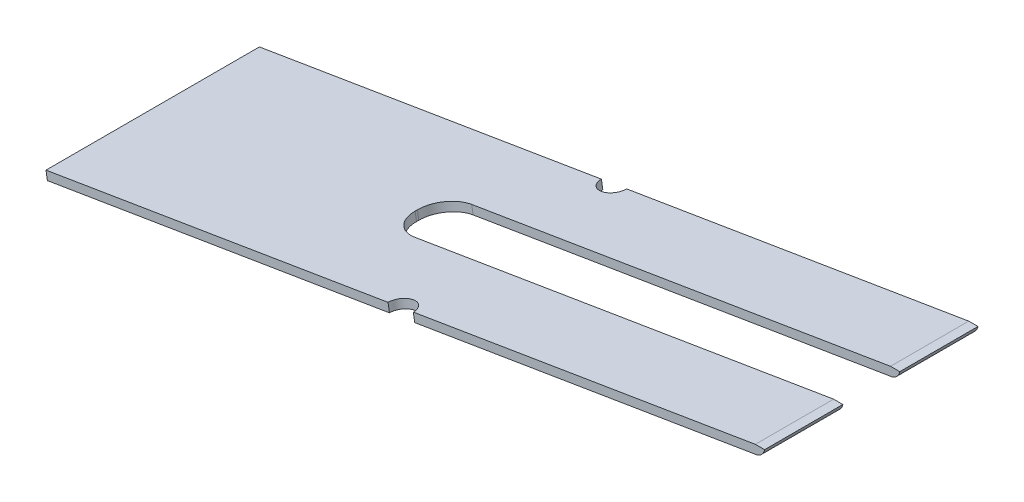
from build123d import *

# Parameters (mm, degrees)
SALIENTE_EXTRUIR1_DEPTH = 1.875
CROQUIS2_R              = 0.225
CORTAR_EXTRUIR1_DEPTH   = 0.3


with BuildPart() as part:
    # Croquis1 → Saliente-Extruir1 (new, symmetric)
    with BuildSketch(Plane.XY):
        with BuildLine():
            Line((4.537261216, -15.5500625), (-7.929262831, -17.609800574))
            Line((-7.929262831, -17.609800574), (-7.9048111, -17.757794198))
            Line((-7.9048111, -17.757794198), (4.561712947, -15.698056124))
            ThreePointArc((4.561712947, -15.698056124), (4.651774684, -15.643632038), (4.699918625, -15.5500625))
            Line((4.699918625, -15.5500625), (4.537261216, -15.5500625))
        make_face()
    extrude(amount=SALIENTE_EXTRUIR1_DEPTH, both=True)

    # Croquis2 → Cortar-Extruir1 (cut)
    with BuildSketch(Plane(origin=(2.645953415, -16.01458083, 0), x_dir=(0.9866241615125322, 0.16301154535704834, 0), z_dir=(0.16301154535704834, -0.9866241615125322, 0))):
        with Locations((-4.376035637, 1.875)):
            Circle(CROQUIS2_R)
        with Locations((-4.376035637, -1.875)):
            Circle(CROQUIS2_R)
        with BuildLine():
            Line((9.881731824, -0.5), (-5.518268176, -0.5))
            ThreePointArc((-5.518268176, -0.5), (-5.857679431, -0.359411255), (-5.998268176, -0.02))
            Line((-5.998268176, -0.02), (-5.998268176, 0.02))
            ThreePointArc((-5.998268176, 0.02), (-5.857679431, 0.359411255), (-5.518268176, 0.5))
            Line((-5.518268176, 0.5), (9.881731824, 0.5))
            Line((9.881731824, 0.5), (9.881731824, -0.5))
        make_face()
    extrude(amount=-CORTAR_EXTRUIR1_DEPTH, mode=Mode.SUBTRACT)


solid = part.part
